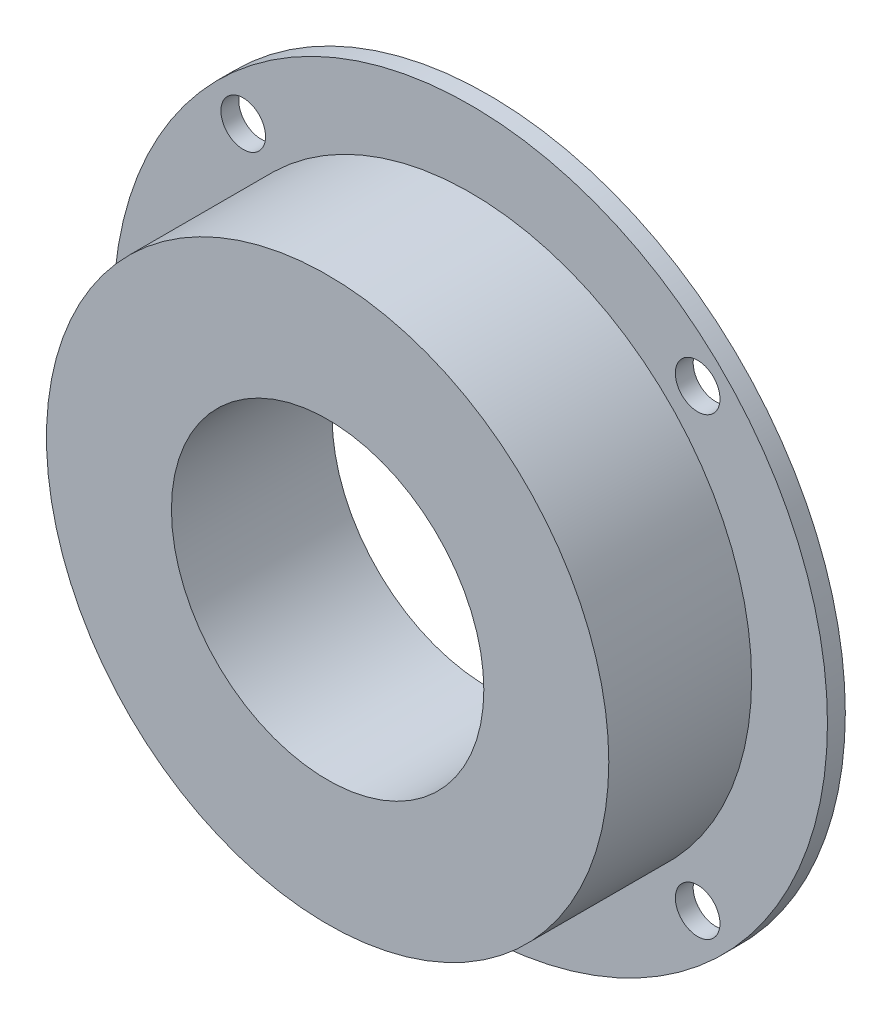
from build123d import *

# Parameters (mm, degrees)
SKETCH2_R           = 40
SKETCH2_R_2         = 17.5
BOSS_EXTRUDE1_DEPTH = 2
SKETCH3_R           = 31.5
SKETCH3_R_2         = 17.5
BOSS_EXTRUDE2_DEPTH = 16
SKETCH5_R           = 2.5
CUT_EXTRUDE1_DEPTH  = 59.787753827


with BuildPart() as part:
    # Sketch2 → Boss-Extrude1 (new body)
    with BuildSketch(Plane.XY):
        Circle(SKETCH2_R)
        Circle(SKETCH2_R_2, mode=Mode.SUBTRACT)
    extrude(amount=BOSS_EXTRUDE1_DEPTH)

    # Sketch3 → Boss-Extrude2 (add)
    with BuildSketch(Plane.XY.offset(2)):
        Circle(SKETCH3_R)
        Circle(SKETCH3_R_2, mode=Mode.SUBTRACT)
    extrude(amount=BOSS_EXTRUDE2_DEPTH)

    # Sketch5 → Cut-Extrude1 (cut, through all)
    with BuildSketch(Plane.XY.offset(2)):
        with Locations((25.455844123, 25.455844123)):
            Circle(SKETCH5_R)
        with Locations((25.455844123, -25.455844123)):
            Circle(SKETCH5_R)
        with Locations((-25.455844123, -25.455844123)):
            Circle(SKETCH5_R)
        with Locations((-25.455844123, 25.455844123)):
            Circle(SKETCH5_R)
    extrude(amount=-CUT_EXTRUDE1_DEPTH, mode=Mode.SUBTRACT)


solid = part.part
